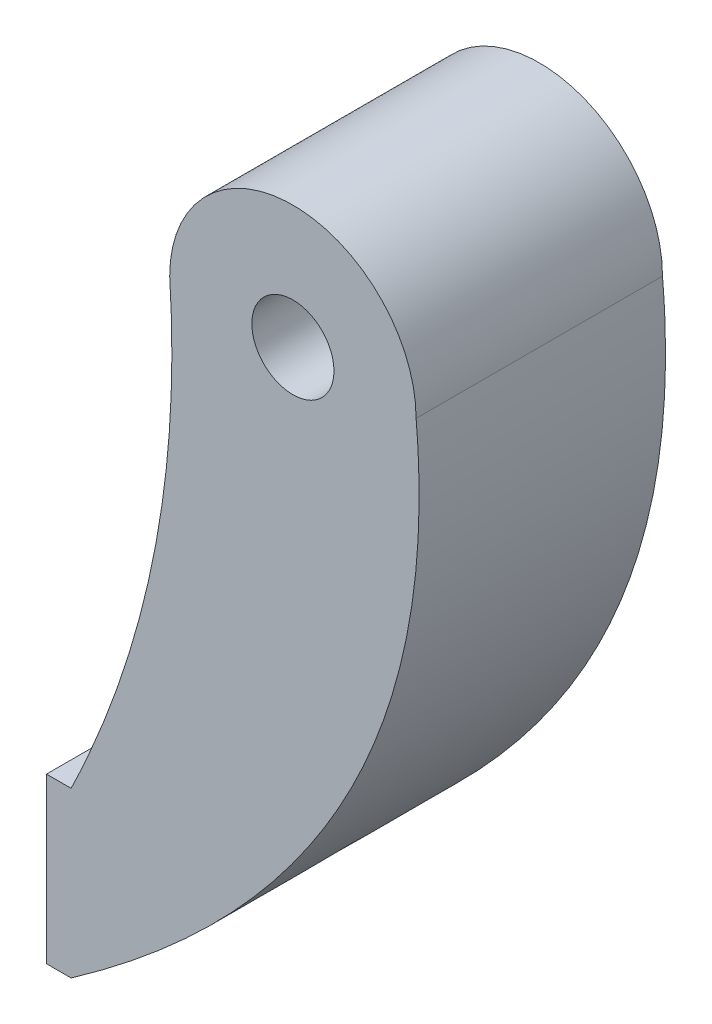
from build123d import *

# Parameters (mm, degrees)
BOSS_EXTRUDE1_DEPTH     = 15
CUT_EXTRUDE1_DEPTH      = 46.276925845
CUT_EXTRUDE1_DEPTH_BACK = 46.276925845
SKETCH2_R               = 2.5


with BuildPart() as part:
    # Sketch1 → Boss-Extrude1 (new body)
    with BuildSketch(Plane.XY):
        with BuildLine():
            Line((-15, -40), (-13.5, -40))
            add(Edge.make_bspline(
                [(7.5, 0), (9.663811458, -23.774808376), (-13.5, -40)],
                knots=[0, 0, 0, 1, 1, 1], degree=2))
            ThreePointArc((7.5, 0), (0, 7.5), (-7.5, 0))
            add(Edge.make_bspline(
                [(-7.5, 0), (-6.464333995, -15.538187235), (-13.5, -30)],
                knots=[0, 0, 0, 1, 1, 1], degree=2))
            Line((-13.5, -30), (-15, -30))
            Line((-15, -30), (-15, -40))
        make_face()
    extrude(amount=BOSS_EXTRUDE1_DEPTH)

    # Sketch2 → Cut-Extrude1 (cut, two sides: drawn at the far end of the back side and taken through both)
    with BuildSketch(Plane.XY.offset(15).offset(-CUT_EXTRUDE1_DEPTH_BACK)):
        Circle(SKETCH2_R)
    extrude(amount=CUT_EXTRUDE1_DEPTH + CUT_EXTRUDE1_DEPTH_BACK, mode=Mode.SUBTRACT)


solid = part.part
